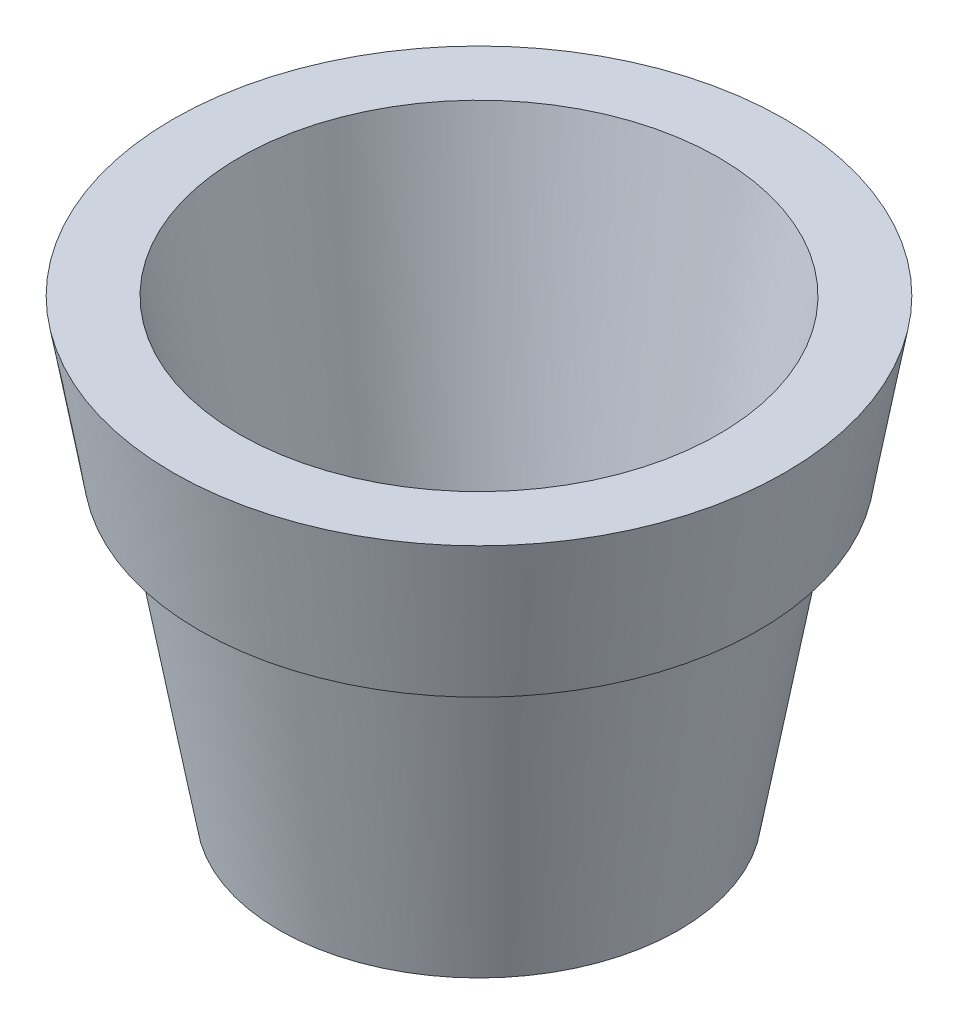
from build123d import *

# Parameters (mm, degrees)
SKETCH1_R           = 20
BOSS_EXTRUDE1_DEPTH = 30
BOSS_EXTRUDE1_DRAFT = -10
SKETCH5_R           = 28
BOSS_EXTRUDE3_DEPTH = 15
BOSS_EXTRUDE3_DRAFT = -10
SKETCH6_R           = 24
CUT_EXTRUDE3_DEPTH  = 40
CUT_EXTRUDE3_DRAFT  = -10
CUT_EXTRUDE4_REACH  = 60.976
SKETCH7_R           = 4


with BuildPart() as part:
    # Sketch1 → Boss-Extrude1 (with draft: the straight prism first)
    with BuildSketch(Plane(origin=(0, 0, 0), x_dir=(1, 0, 0), z_dir=(0, 1, 0))):
        Circle(SKETCH1_R)
    extrude(amount=BOSS_EXTRUDE1_DEPTH)
    # Boss-Extrude1: the draft: its side faces are tilted about the plane it starts from
    boss_extrude1_sides = [part.faces().sort_by_distance(p)[0] for p in [
        (-20, 15, 0),
    ]]
    draft(boss_extrude1_sides, Plane(origin=(0, 0, 0), x_dir=(1, 0, 0), z_dir=(0, 1, 0)), BOSS_EXTRUDE1_DRAFT)


with BuildPart() as boss_extrude3_tool:
    # Sketch5 → Boss-Extrude3 (with draft: the straight prism first)
    with BuildSketch(Plane(origin=(0, 30, 0), x_dir=(1, 0, 0), z_dir=(0, 1, 0))):
        Circle(SKETCH5_R)
    extrude(amount=BOSS_EXTRUDE3_DEPTH)
    # Boss-Extrude3: the draft: its side faces are tilted about the plane it starts from
    boss_extrude3_sides = [boss_extrude3_tool.faces().sort_by_distance(p)[0] for p in [
        (-28, 37.5, 0),
    ]]
    draft(boss_extrude3_sides, Plane(origin=(0, 30, 0), x_dir=(1, 0, 0), z_dir=(0, 1, 0)), BOSS_EXTRUDE3_DRAFT)


with BuildPart() as part_1:
    add(part.part)

    # Boss-Extrude3: add boss_extrude3_tool
    add(boss_extrude3_tool.part)


with BuildPart() as cut_extrude3_tool:
    # Sketch6 → Cut-Extrude3 (with draft: the straight prism first)
    with BuildSketch(Plane(origin=(0, 45, 0), x_dir=(1, 0, 0), z_dir=(0, 1, 0))):
        Circle(SKETCH6_R)
    extrude(amount=-CUT_EXTRUDE3_DEPTH)
    # Cut-Extrude3: the draft: its side faces are tilted about the plane it starts from
    cut_extrude3_sides = [cut_extrude3_tool.faces().sort_by_distance(p)[0] for p in [
        (-24, 25, 0),
    ]]
    draft(cut_extrude3_sides, Plane(origin=(0, 45, 0), x_dir=(1, 0, 0), z_dir=(0, 1, 0)), CUT_EXTRUDE3_DRAFT)


with BuildPart() as part_2:
    add(part_1.part)

    # Cut-Extrude3: cut by cut_extrude3_tool
    add(cut_extrude3_tool.part, mode=Mode.SUBTRACT)

    # Sketch7 → Cut-Extrude4 (cut, up to next)
    with BuildSketch(Plane(origin=(0, 5, 0), x_dir=(1, 0, 0), z_dir=(0, 1, 0)), mode=Mode.PRIVATE) as cut_extrude4_sk1:
        with Locations(Location((0, 0, 0), (0, 0, 270))):
            Circle(SKETCH7_R)
    cut_extrude4_tool1 = extrude(cut_extrude4_sk1.sketch, amount=-CUT_EXTRUDE4_REACH, mode=Mode.PRIVATE) & part_2.part
    add(cut_extrude4_tool1.solids().sort_by_distance((0, 5, 0))[0], mode=Mode.SUBTRACT)


solid = part_2.part
